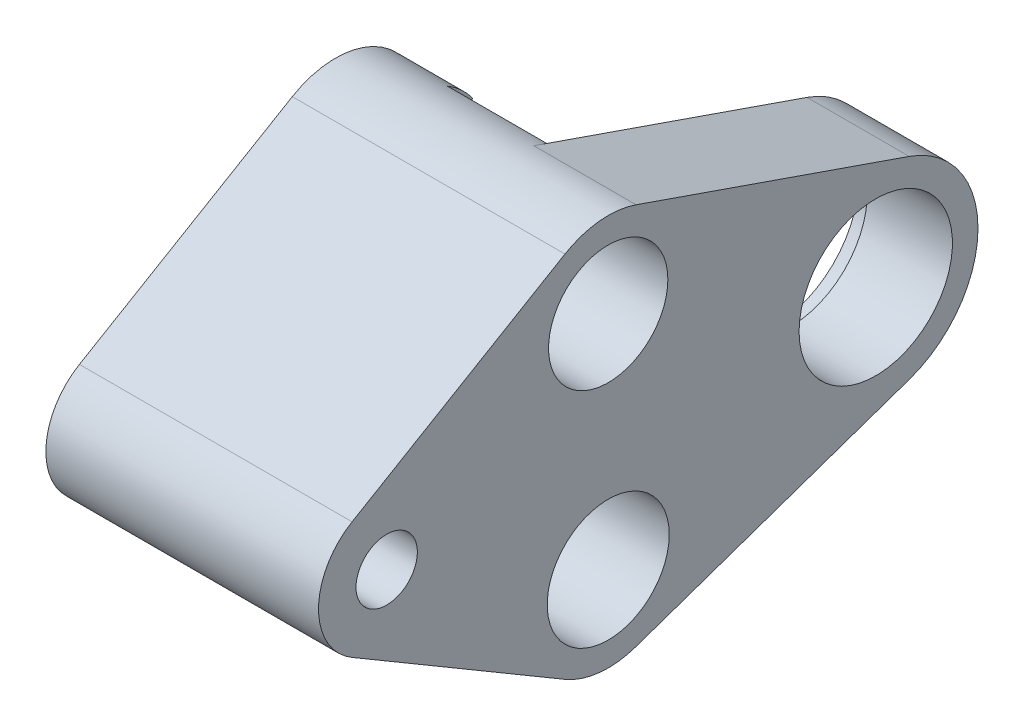
from build123d import *

# Parameters (mm, degrees)
SKETCH1_R           = 5.715
SKETCH1_R_2         = 2.286
BOSS_EXTRUDE1_DEPTH = 7.62
BOSS_EXTRUDE2_START = 12.7
SKETCH2_R           = 2.286
BOSS_EXTRUDE2_DEPTH = 12.7
SKETCH3_R           = 6.35
CUT_EXTRUDE1_DEPTH  = 1.27
SKETCH5_R           = 21.59
CUT_EXTRUDE3_DEPTH  = 7.62
CUT_EXTRUDE2_START  = -15.24
SKETCH4_R           = 4.5466
SKETCH4_R_2         = 4.445
CUT_EXTRUDE2_DEPTH  = 15.24


with BuildPart() as part:
    # Sketch1 → Boss-Extrude1 (new body)
    with BuildSketch(Plane(origin=(0, 0, 0), x_dir=(0, 0, -1), z_dir=(1, 0, 0))):
        with BuildLine():
            Line((2.079548127, 22.50983163), (22.434457752, 15.454797956))
            ThreePointArc((22.434457752, 15.454797956), (27.559, 8.255), (22.434457752, 1.055202044))
            Line((22.434457752, 1.055202044), (2.079548127, -5.99983163))
            ThreePointArc((2.079548127, -5.99983163), (-0.630342168, -6.318636621), (-3.223846154, -5.470769231))
            Line((-3.223846154, -5.470769231), (-19.089076923, 3.878384615))
            ThreePointArc((-19.089076923, 3.878384615), (-21.59, 8.255), (-19.089076923, 12.631615385))
            Line((-19.089076923, 12.631615385), (-3.223846154, 21.980769231))
            ThreePointArc((-3.223846154, 21.980769231), (-0.630342168, 22.828636621), (2.079548127, 22.50983163))
        make_face()
        with Locations(Location((19.939, 8.255, 0), (0, 0, 180))):
            Circle(SKETCH1_R, mode=Mode.SUBTRACT)
        with Locations(Location((0, 16.51, 0), (0, 0, 180))):
            Circle(SKETCH1_R_2, mode=Mode.SUBTRACT)
        with Locations(Location((0, 0, 0), (0, 0, 180))):
            Circle(SKETCH1_R_2, mode=Mode.SUBTRACT)
        with Locations(Location((-16.51, 8.255, 0), (0, 0, 180))):
            Circle(SKETCH1_R_2, mode=Mode.SUBTRACT)
    extrude(amount=BOSS_EXTRUDE1_DEPTH)

    # Sketch2 → Boss-Extrude2 (add)
    with BuildSketch(Plane.ZY.offset(BOSS_EXTRUDE2_START)):
        with BuildLine():
            Line((19.089076923, 12.631615385), (3.223846154, 21.980769231))
            ThreePointArc((3.223846154, 21.980769231), (0.630342168, 22.828636621), (-2.079548127, 22.50983163))
            ThreePointArc((-2.079548127, 22.50983163), (-3.781080863, 21.611561281), (-5.1354637, 20.244904629))
            ThreePointArc((-5.1354637, 20.244904629), (-0.889, 8.255), (-5.1354637, -3.734904629))
            ThreePointArc((-5.1354637, -3.734904629), (-3.781080863, -5.101561281), (-2.079548127, -5.99983163))
            ThreePointArc((-2.079548127, -5.99983163), (0.630342168, -6.318636621), (3.223846154, -5.470769231))
            Line((3.223846154, -5.470769231), (19.089076923, 3.878384615))
            ThreePointArc((19.089076923, 3.878384615), (21.59, 8.255), (19.089076923, 12.631615385))
        make_face()
        Circle(SKETCH2_R, mode=Mode.SUBTRACT)
        with Locations((0, 16.51)):
            Circle(SKETCH2_R, mode=Mode.SUBTRACT)
        with Locations((16.51, 8.255)):
            Circle(SKETCH2_R, mode=Mode.SUBTRACT)
    extrude(amount=-BOSS_EXTRUDE2_DEPTH)

    # Sketch3 → Cut-Extrude1 (cut)
    with BuildSketch(Plane.ZY):
        with Locations((-19.939, 8.255)):
            Circle(SKETCH3_R)
    extrude(amount=-CUT_EXTRUDE1_DEPTH, mode=Mode.SUBTRACT)

    # Sketch5 → Cut-Extrude3 (cut)
    with BuildSketch(Plane.ZY):
        with Locations((-19.939, 8.255)):
            Circle(SKETCH5_R)
    extrude(amount=CUT_EXTRUDE3_DEPTH, mode=Mode.SUBTRACT)

    # Sketch4 → Cut-Extrude2 (cut)
    with BuildSketch(Plane(origin=(7.62, 0, 0), x_dir=(0, 0, -1), z_dir=(1, 0, 0)).offset(CUT_EXTRUDE2_START)):
        Circle(SKETCH4_R)
        with Locations((0, 16.51)):
            Circle(SKETCH4_R_2)
    extrude(amount=CUT_EXTRUDE2_DEPTH, mode=Mode.SUBTRACT)


solid = part.part
